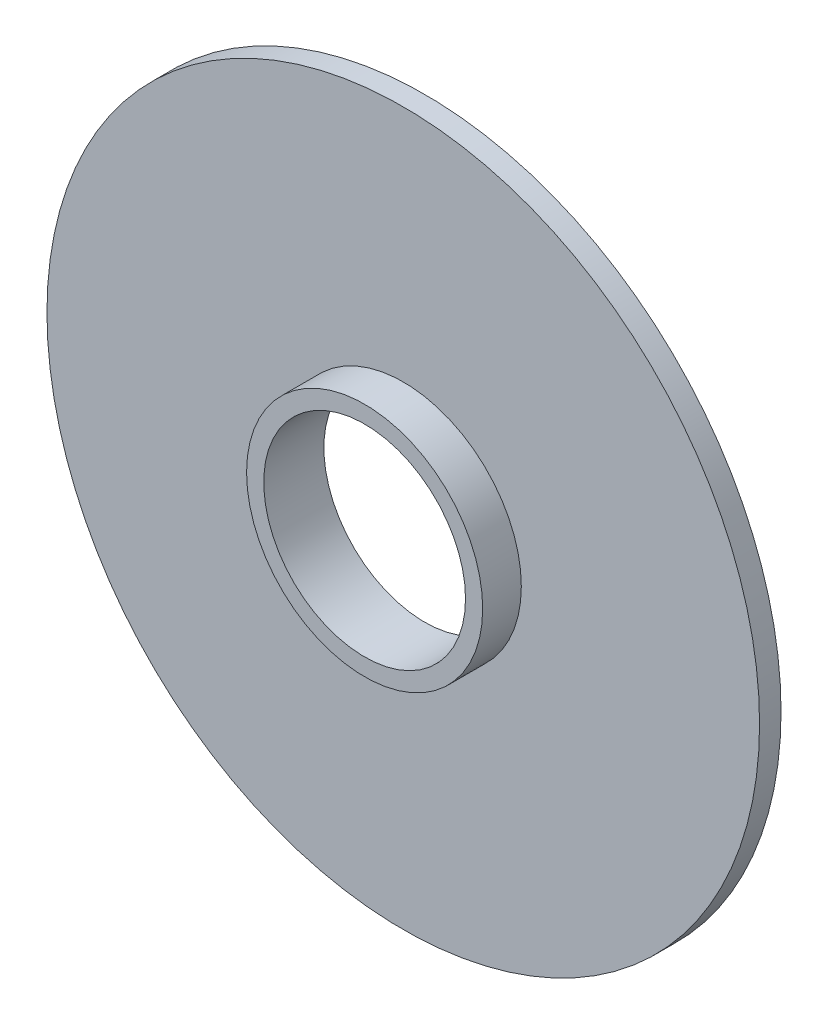
from build123d import *

# Parameters (mm, degrees)
COVER_WEB_START    = -40
SKETCH_1_R         = 83
SKETCH_1_R_2       = 23.5
COVER_WEB_DEPTH    = 5
BEARING_BOSS_START = -40
SKETCH_2_R         = 27.5
SKETCH_2_R_2       = 23.5
BEARING_BOSS_DEPTH = 14


with BuildPart() as part:
    # Эскиз1 → Cover_web (new body)
    with BuildSketch(Plane.XY.offset(COVER_WEB_START)):
        Circle(SKETCH_1_R)
        Circle(SKETCH_1_R_2, mode=Mode.SUBTRACT)
    extrude(amount=COVER_WEB_DEPTH)

    # Эскиз2 → Bearing_boss (add)
    with BuildSketch(Plane.XY.offset(BEARING_BOSS_START)):
        Circle(SKETCH_2_R)
        Circle(SKETCH_2_R_2, mode=Mode.SUBTRACT)
    extrude(amount=BEARING_BOSS_DEPTH)


solid = part.part
